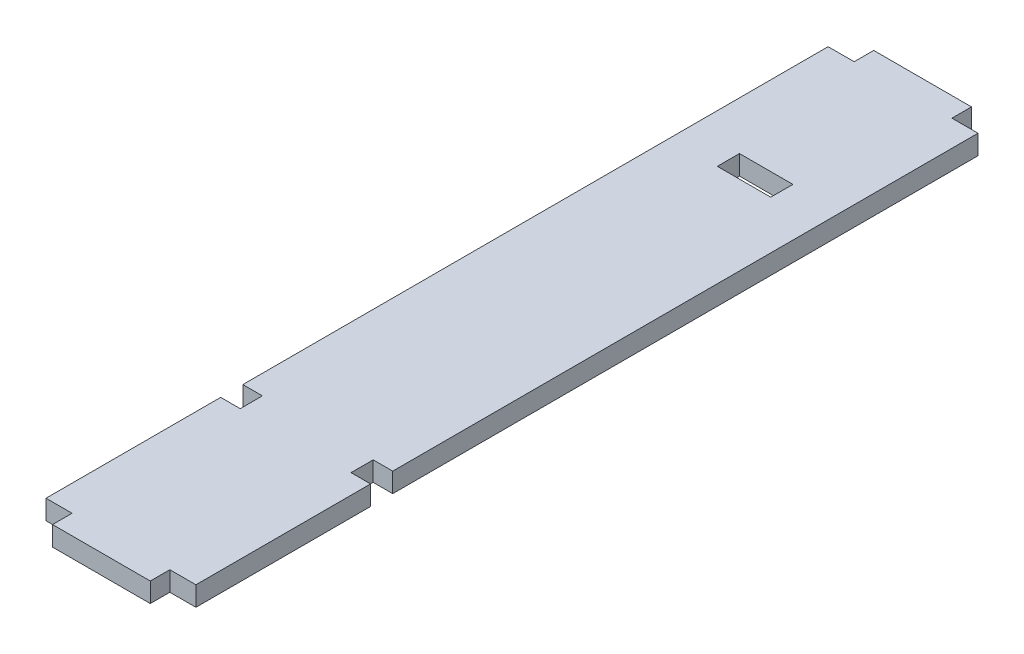
from build123d import *

# Parameters (mm, degrees)
SKETCH1_W           = 4.1
SKETCH1_H           = 1.7
BOSS_EXTRUDE1_DEPTH = 1.5


with BuildPart() as part:
    # Sketch1 → Boss-Extrude1 (new body)
    with BuildSketch(Plane(origin=(0, 0, 0), x_dir=(1, 0, 0), z_dir=(0, 1, 0))):
        Polygon((3.75, 30), (5.75, 30), (5.75, -14.9), (4.25, -14.9), (4.25, -16.6), (5.75, -16.6), (5.75, -30), (3.75, -30), (3.75, -31.5), (-3.75, -31.5), (-3.75, -30), (-5.75, -30), (-5.75, -16.6), (-4.25, -16.6), (-4.25, -14.9), (-5.75, -14.9), (-5.75, 30), (-3.75, 30), (-3.75, 31.5), (3.75, 31.5), align=None)
        with Locations((0, 18.65)):
            Rectangle(SKETCH1_W, SKETCH1_H, mode=Mode.SUBTRACT)
    extrude(amount=BOSS_EXTRUDE1_DEPTH)


solid = part.part
